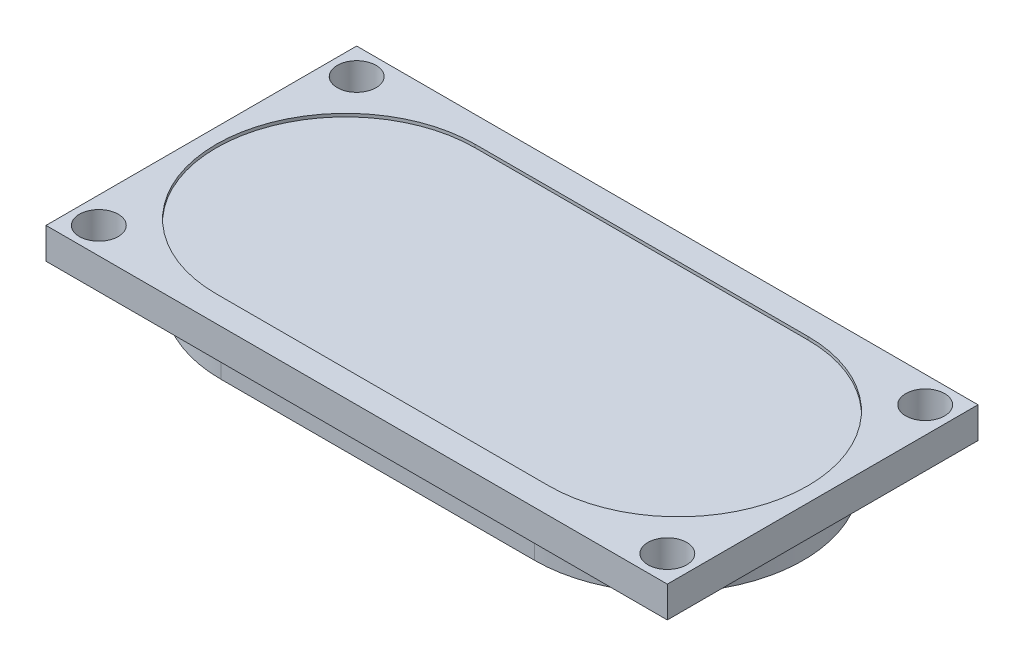
from build123d import *

# Parameters (mm, degrees)
SKETCH4_W           = 40
SKETCH4_H           = 20
BOSS_EXTRUDE2_DEPTH = 2
SKETCH5_R           = 1.25
CUT_EXTRUDE1_DEPTH  = 23.449944321
BOSS_EXTRUDE3_DEPTH = 2.3
SKETCH7_R           = 7.25
BOSS_EXTRUDE4_DEPTH = 1.2
CUT_EXTRUDE2_DEPTH  = 0.2


with BuildPart() as part:
    # Sketch4 → Boss-Extrude2 (new body)
    with BuildSketch(Plane(origin=(0, 0, 0), x_dir=(1, 0, 0), z_dir=(0, 1, 0))):
        Rectangle(SKETCH4_W, SKETCH4_H)
    extrude(amount=BOSS_EXTRUDE2_DEPTH)

    # Sketch5 → Cut-Extrude1 (cut, through all)
    with BuildSketch(Plane(origin=(0, 2, 0), x_dir=(1, 0, 0), z_dir=(0, 1, 0))):
        with Locations(Location((-18.3, 8.3, 0), (0, 0, 270))):
            Circle(SKETCH5_R)
        with Locations(Location((18.3, 8.3, 0), (0, 0, 270))):
            Circle(SKETCH5_R)
        with Locations(Location((-18.3, -8.3, 0), (0, 0, 270))):
            Circle(SKETCH5_R)
        with Locations(Location((18.3, -8.3, 0), (0, 0, 270))):
            Circle(SKETCH5_R)
    extrude(amount=-CUT_EXTRUDE1_DEPTH, mode=Mode.SUBTRACT)

    # Sketch6 → Boss-Extrude3 (add)
    with BuildSketch(Plane.XZ):
        with BuildLine():
            Line((-10.1, 8.65), (10.1, 8.65))
            ThreePointArc((10.1, 8.65), (18.75, 0), (10.1, -8.65))
            Line((10.1, -8.65), (-10.1, -8.65))
            ThreePointArc((-10.1, -8.65), (-18.75, 0), (-10.1, 8.65))
        make_face()
    extrude(amount=BOSS_EXTRUDE3_DEPTH)

    # Sketch7 → Boss-Extrude4 (add)
    with BuildSketch(Plane.XZ.offset(2.3)):
        with Locations(Location((0, 0, 0), (0, 0, 270))):
            Circle(SKETCH7_R)
    extrude(amount=BOSS_EXTRUDE4_DEPTH)

    # Sketch8 → Cut-Extrude2 (cut)
    with BuildSketch(Plane(origin=(0, 2, 0), x_dir=(1, 0, 0), z_dir=(0, 1, 0))):
        with BuildLine():
            Line((-10.706568747, 8.336924947), (10.706568747, 8.336924947))
            ThreePointArc((10.706568747, 8.336924947), (19.043493695, 0), (10.706568747, -8.336924947))
            Line((10.706568747, -8.336924947), (-10.706568747, -8.336924947))
            ThreePointArc((-10.706568747, -8.336924947), (-19.043493695, 0), (-10.706568747, 8.336924947))
        make_face()
    extrude(amount=-CUT_EXTRUDE2_DEPTH, mode=Mode.SUBTRACT)


solid = part.part
